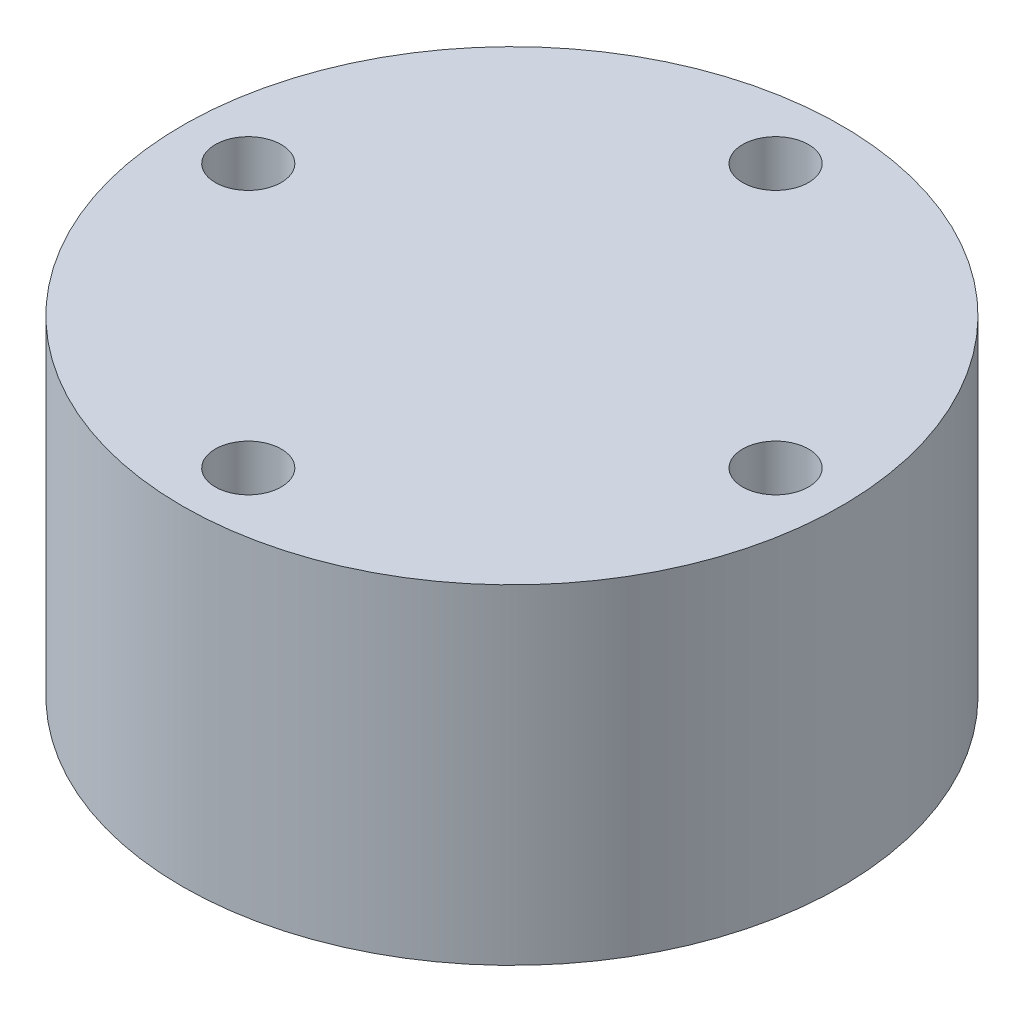
from build123d import *

# Parameters (mm, degrees)
SKETCH1_R           = 5
SKETCH1_R_2         = 0.5
BOSS_EXTRUDE1_DEPTH = 5


with BuildPart() as part:
    # Sketch1 → Boss-Extrude1 (new body)
    with BuildSketch(Plane(origin=(0, 0, 0), x_dir=(1, 0, 0), z_dir=(0, 1, 0))):
        with Locations(Location((0, 0, 0), (0, 0, 270))):
            Circle(SKETCH1_R)
        with Locations(Location((0, 4, 0), (0, 0, 270))):
            Circle(SKETCH1_R_2, mode=Mode.SUBTRACT)
        with Locations(Location((4, 0, 0), (0, 0, 270))):
            Circle(SKETCH1_R_2, mode=Mode.SUBTRACT)
        with Locations(Location((0, -4, 0), (0, 0, 270))):
            Circle(SKETCH1_R_2, mode=Mode.SUBTRACT)
        with Locations(Location((-4, 0, 0), (0, 0, 270))):
            Circle(SKETCH1_R_2, mode=Mode.SUBTRACT)
    extrude(amount=BOSS_EXTRUDE1_DEPTH)


solid = part.part
